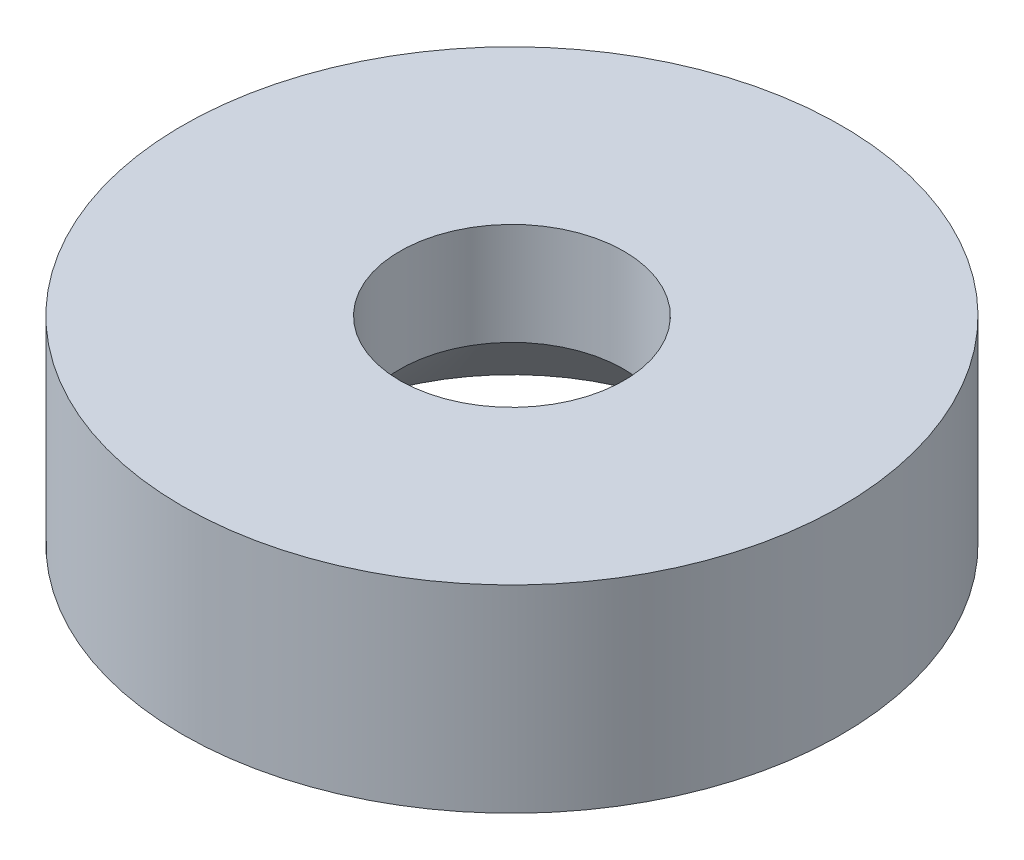
from build123d import *

# Parameters (mm, degrees)
SKETCH1_R           = 5
BOSS_EXTRUDE1_DEPTH = 3


with BuildPart() as part:
    # Sketch1 → Boss-Extrude1 (new body)
    with BuildSketch(Plane(origin=(0, 0, 0), x_dir=(1, 0, 0), z_dir=(0, 1, 0))):
        with Locations(Location((0.475848056, -0.924139707, 0), (0, 0, 270))):
            Circle(SKETCH1_R)
    extrude(amount=BOSS_EXTRUDE1_DEPTH)

    # Sketch3 → CSK for M3 Flat Head Machine Screw1 (revolve, cut)
    with BuildSketch(Plane(origin=(0.475848056, 0, 0.924139707), x_dir=(0, 0, -1), z_dir=(1, 0, 0))):
        Polygon((0, 0), (0, 3), (1.7, 3), (1.7, 1.45), (3.15, 0), align=None)
    revolve(axis=Axis((0.475848056, -6.35, 0.924139707), (0, 1, 0)), mode=Mode.SUBTRACT)


solid = part.part
